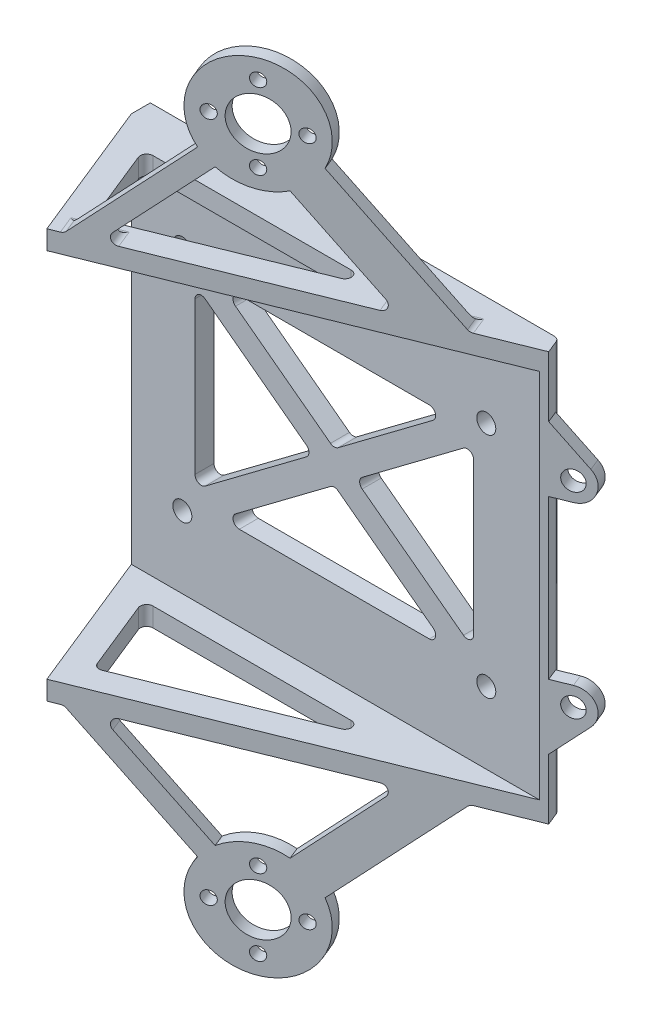
from build123d import *

# Parameters (mm, degrees)
SKETCH_2_W          = 64.445610825
SKETCH_2_H          = 64.602792554
EXTRUDE_2_DEPTH     = 3
SKETCH_3_R          = 1.5
CUT_EXTRUDE_1_DEPTH = 4
EXTRUDE_3_DEPTH     = 3
EXTRUDE_4_DEPTH     = 3
EXTRUDE_6_DEPTH     = 64.602792554
SKETCH_11_R         = 3
SKETCH_11_R_2       = 1.55
SKETCH_11_R_3       = 9
SKETCH_11_R_4       = 1.05
SKETCH_11_R_5       = 4
EXTRUDE_7_DEPTH     = 2
FILLET_1_R          = 1
FILLET_2_R          = 1
FILLET_3_R          = 1
CUT_EXTRUDE_3_DEPTH = 78.212432343
FILLET_5_R          = 1


with BuildPart() as part:
    # 草图2 → 凸台-拉伸2 (new body)
    with BuildSketch(Plane.XY):
        with Locations((0.170214688, -0.018389364)):
            Rectangle(SKETCH_2_W, SKETCH_2_H)
    extrude(amount=EXTRUDE_2_DEPTH)

    # 草图3 → 切除-拉伸1 (cut)
    with BuildSketch(Plane.XY):
        with Locations((24, -18)):
            Circle(SKETCH_3_R)
        with Locations((-24, -18)):
            Circle(SKETCH_3_R)
        with Locations((-24, 18)):
            Circle(SKETCH_3_R)
        with Locations((24, 18)):
            Circle(SKETCH_3_R)
    extrude(amount=CUT_EXTRUDE_1_DEPTH, mode=Mode.SUBTRACT)

    # 草图9 → 凸台-拉伸3 (add)
    with BuildSketch(Plane(origin=(0, 32.283006913, 0), x_dir=(1, 0, 0), z_dir=(0, 1, 0))):
        Polygon((-32.052590724, -3), (32.393020101, -3), (-23.008931723, -25.383841499), align=None)
        Polygon((-20.798622679, -20.176679707), (11.814804037, -7), (-26.12234685, -7), align=None, mode=Mode.SUBTRACT)
    extrude(amount=-EXTRUDE_3_DEPTH)

    # 草图10 → 凸台-拉伸4 (add)
    with BuildSketch(Plane.XZ.offset(32.319785641)):
        Polygon((-23.008931723, 25.383841499), (-32.052590724, 3), (32.393020101, 3), align=None)
        Polygon((11.814804037, 7), (-20.798622679, 20.176679707), (-26.12234685, 7), align=None, mode=Mode.SUBTRACT)
    extrude(amount=-EXTRUDE_4_DEPTH)

    # 草图13 → 凸台-拉伸6 (add)
    with BuildSketch(Plane(origin=(0, 32.283006913, 0), x_dir=(1, 0, 0), z_dir=(0, 1, 0))):
        Polygon((32.393020101, -3), (33.435007656, -2.579009701), (32.393020101, 0), align=None)
    extrude(amount=-EXTRUDE_6_DEPTH)

    # 草图11 → 凸台-拉伸7 (add)
    # profile 1 of 14: a face of its own
    with BuildSketch(Plane(origin=(5.5877033, 0, 13.830050979), x_dir=(0.9271838545667869, 0, -0.37460659341591335), z_dir=(0.37460659341591335, 0, 0.9271838545667869))):
        with BuildLine():
            Line((30.912964894, 13.360290293), (30.034285238, 14.238969949))
            Line((30.034285238, 14.238969949), (30.034285238, 12.481610636))
            Line((30.034285238, 12.481610636), (33.034285238, 12.481610636))
            ThreePointArc((33.034285238, 12.481610636), (31.886234941, 12.709972039), (30.912964894, 13.360290293))
        make_face()
    # profile 2 of 14: a face of its own
    with BuildSketch(Plane(origin=(5.5877033, 0, 13.830050979), x_dir=(0.9271838545667869, 0, -0.37460659341591335), z_dir=(0.37460659341591335, 0, 0.9271838545667869))):
        with Locations((33.034285238, 15.481610636)):
            Circle(SKETCH_11_R)
        with Locations((33.034285238, 15.481610636)):
            Circle(SKETCH_11_R_2, mode=Mode.SUBTRACT)
    # profile 3 of 14: a face of its own
    with BuildSketch(Plane(origin=(5.5877033, 0, 13.830050979), x_dir=(0.9271838545667869, 0, -0.37460659341591335), z_dir=(0.37460659341591335, 0, 0.9271838545667869))):
        with BuildLine():
            Line((30.034285238, 15.481610693), (30.034285238, 14.238969949))
            Line((30.034285238, 14.238969949), (30.912964894, 13.360290293))
            ThreePointArc((30.912964894, 13.360290293), (30.26264663, 14.333560365), (30.034285238, 15.481610693))
        make_face()
    # profile 4 of 14: a face of its own
    with BuildSketch(Plane(origin=(5.5877033, 0, 13.830050979), x_dir=(0.9271838545667869, 0, -0.37460659341591335), z_dir=(0.37460659341591335, 0, 0.9271838545667869))):
        with BuildLine():
            Line((35.155605582, 17.60293098), (30.034285238, 22.724251323))
            Line((30.034285238, 22.724251323), (30.034285238, 15.481610693))
            ThreePointArc((30.034285238, 15.481610693), (31.886234967, 18.253249245), (35.155605582, 17.60293098))
        make_face()
    # profile 5 of 14: a face of its own
    with BuildSketch(Plane(origin=(5.5877033, 0, 13.830050979), x_dir=(0.9271838545667869, 0, -0.37460659341591335), z_dir=(0.37460659341591335, 0, 0.9271838545667869))):
        with Locations((33.034285238, -15.518389364)):
            Circle(SKETCH_11_R)
        with Locations((33.034285238, -15.518389364)):
            Circle(SKETCH_11_R_2, mode=Mode.SUBTRACT)
    # profile 6 of 14: a face of its own
    with BuildSketch(Plane(origin=(5.5877033, 0, 13.830050979), x_dir=(0.9271838545667869, 0, -0.37460659341591335), z_dir=(0.37460659341591335, 0, 0.9271838545667869))):
        with BuildLine():
            Line((30.912964894, -13.39706902), (30.034285238, -14.275748677))
            Line((30.034285238, -14.275748677), (30.034285238, -15.518389325))
            ThreePointArc((30.034285238, -15.518389325), (30.262646648, -14.370339049), (30.912964894, -13.39706902))
        make_face()
    # profile 7 of 14: a face of its own
    with BuildSketch(Plane(origin=(5.5877033, 0, 13.830050979), x_dir=(0.9271838545667869, 0, -0.37460659341591335), z_dir=(0.37460659341591335, 0, 0.9271838545667869))):
        with BuildLine():
            Line((33.034285238, -12.518389364), (30.034285238, -12.518389364))
            Line((30.034285238, -12.518389364), (30.034285238, -14.275748677))
            Line((30.034285238, -14.275748677), (30.912964894, -13.39706902))
            ThreePointArc((30.912964894, -13.39706902), (31.886234941, -12.746750766), (33.034285238, -12.518389364))
        make_face()
    # profile 8 of 14: a face of its own
    with BuildSketch(Plane(origin=(5.5877033, 0, 13.830050979), x_dir=(0.9271838545667869, 0, -0.37460659341591335), z_dir=(0.37460659341591335, 0, 0.9271838545667869))):
        with BuildLine():
            ThreePointArc((35.155605582, -17.639709707), (31.886234923, -18.290027954), (30.034285238, -15.518389325))
            Line((30.034285238, -15.518389325), (30.034285238, -22.761030051))
            Line((30.034285238, -22.761030051), (35.155605582, -17.639709707))
        make_face()
    # profile 9 of 14: a face of its own
    with BuildSketch(Plane(origin=(5.5877033, 0, 13.830050979), x_dir=(0.9271838545667869, 0, -0.37460659341591335), z_dir=(0.37460659341591335, 0, 0.9271838545667869))):
        with BuildLine():
            Line((20.475529648, -32.319785641), (11.990248274, -32.319785641))
            Line((11.990248274, -32.319785641), (-1.337035106, -45.64706902))
            ThreePointArc((-1.337035106, -45.64706902), (1.148246269, -47.404428333), (2.905605582, -49.889709707))
            Line((2.905605582, -49.889709707), (20.475529648, -32.319785641))
        make_face()
    # profile 10 of 14: a face of its own
    with BuildSketch(Plane(origin=(5.5877033, 0, 13.830050979), x_dir=(0.9271838545667869, 0, -0.37460659341591335), z_dir=(0.37460659341591335, 0, 0.9271838545667869))):
        with Locations((-5.215714762, -53.768389364)):
            Circle(SKETCH_11_R_3)
        with Locations((-11.215714762, -53.768389364)):
            Circle(SKETCH_11_R_4, mode=Mode.SUBTRACT)
        with Locations((-5.215714762, -53.768389364)):
            Circle(SKETCH_11_R_5, mode=Mode.SUBTRACT)
        with Locations((-5.215714762, -47.768389364)):
            Circle(SKETCH_11_R_4, mode=Mode.SUBTRACT)
        with Locations((0.784285238, -53.768389364)):
            Circle(SKETCH_11_R_4, mode=Mode.SUBTRACT)
        with Locations((-5.215714762, -59.768389364)):
            Circle(SKETCH_11_R_4, mode=Mode.SUBTRACT)
    # profile 11 of 14: a face of its own
    with BuildSketch(Plane(origin=(5.5877033, 0, 13.830050979), x_dir=(0.9271838545667869, 0, -0.37460659341591335), z_dir=(0.37460659341591335, 0, 0.9271838545667869))):
        with BuildLine():
            Line((-10.430004789, -46.432778993), (-24.542998142, -32.319785641))
            Line((-24.542998142, -32.319785641), (-28.785638829, -32.319785641))
            Line((-28.785638829, -32.319785641), (-12.551325133, -48.554099337))
            ThreePointArc((-12.551325133, -48.554099337), (-11.579675793, -47.404428333), (-10.430004789, -46.432778993))
        make_face()
    # profile 12 of 14: a face of its own
    with BuildSketch(Plane(origin=(5.5877033, 0, 13.830050979), x_dir=(0.9271838545667869, 0, -0.37460659341591335), z_dir=(0.37460659341591335, 0, 0.9271838545667869))):
        with BuildLine():
            Line((20.475529648, 32.283006913), (2.905605582, 49.85293098))
            ThreePointArc((2.905605582, 49.85293098), (1.148246269, 47.367649606), (-1.337035106, 45.610290293))
            Line((-1.337035106, 45.610290293), (11.990248274, 32.283006913))
            Line((11.990248274, 32.283006913), (20.475529648, 32.283006913))
        make_face()
    # profile 13 of 14: a face of its own
    with BuildSketch(Plane(origin=(5.5877033, 0, 13.830050979), x_dir=(0.9271838545667869, 0, -0.37460659341591335), z_dir=(0.37460659341591335, 0, 0.9271838545667869))):
        with BuildLine():
            ThreePointArc((-10.430004789, 46.396000265), (-11.579675793, 47.367649606), (-12.551325133, 48.517320609))
            Line((-12.551325133, 48.517320609), (-28.785638829, 32.283006913))
            Line((-28.785638829, 32.283006913), (-24.542998142, 32.283006913))
            Line((-24.542998142, 32.283006913), (-10.430004789, 46.396000265))
        make_face()
    # profile 14 of 14: a face of its own
    with BuildSketch(Plane(origin=(5.5877033, 0, 13.830050979), x_dir=(0.9271838545667869, 0, -0.37460659341591335), z_dir=(0.37460659341591335, 0, 0.9271838545667869))):
        with Locations((-5.215714762, 53.731610636)):
            Circle(SKETCH_11_R_3)
        with Locations((-11.215714762, 53.731610636)):
            Circle(SKETCH_11_R_4, mode=Mode.SUBTRACT)
        with Locations((-5.215714762, 53.731610636)):
            Circle(SKETCH_11_R_5, mode=Mode.SUBTRACT)
        with Locations((-5.215714762, 59.731610636)):
            Circle(SKETCH_11_R_4, mode=Mode.SUBTRACT)
        with Locations((0.784285238, 53.731610636)):
            Circle(SKETCH_11_R_4, mode=Mode.SUBTRACT)
        with Locations((-5.215714762, 47.731610636)):
            Circle(SKETCH_11_R_4, mode=Mode.SUBTRACT)
    extrude(amount=-EXTRUDE_7_DEPTH)

    # 圆角1
    fillet_1_edges = [part.edges().sort_by_distance(p)[0] for p in [
        (32.393020101, -0.018389364, 0),
    ]]
    fillet(fillet_1_edges, radius=FILLET_1_R)

    # 圆角2
    fillet_2_edges = [part.edges().sort_by_distance(p)[0] for p in [
        (16.330261319, -32.319785641, 8.411241064),
        (24.19767721, -32.319785641, 5.232598715),
        (-21.476482859, -32.319785641, 23.686157226),
        (-17.542774913, -32.319785641, 22.096836051),
        (19.889362671, -32.319785641, 5.894736035),
        (-19.884235479, -32.319785641, 21.964312784),
        (24.19767721, 32.283006913, 5.232598715),
        (16.330261319, 32.283006913, 8.411241064),
        (-17.542774913, 32.283006913, 22.096836051),
        (-21.476482859, 32.283006913, 23.686157226),
        (19.889362671, 32.283006913, 5.894736035),
        (-19.884235479, 32.283006913, 21.964312784),
    ]]
    fillet(fillet_2_edges, radius=FILLET_2_R)

    # 圆角3
    fillet_3_edges = [part.edges().sort_by_distance(p)[0] for p in [
        (-26.12234685, 30.783006913, 7),
        (11.814804037, 30.783006913, 7),
        (-20.798622679, 30.783006913, 20.176679707),
        (-26.12234685, -30.819785641, 7),
        (-20.798622679, -30.819785641, 20.176679707),
        (11.814804037, -30.819785641, 7),
    ]]
    fillet(fillet_3_edges, radius=FILLET_3_R)

    # 草图15 → 切除-拉伸3 (cut, through all)
    with BuildSketch(Plane.XY.offset(3)):
        Polygon((-18, 16), (18, 16), (0, 2.5), align=None)
        Polygon((-22, 14), (-3.333333333, 0), (-22, -14), align=None)
        Polygon((-18, -16), (18, -16), (0, -2.5), align=None)
        Polygon((22, 14), (3.333333333, 0), (22, -14), align=None)
    extrude(amount=-CUT_EXTRUDE_3_DEPTH, mode=Mode.SUBTRACT)

    # 圆角5
    fillet_5_edges = [part.edges().sort_by_distance(p)[0] for p in [
        (-18, -16, 1.5),
        (0, -2.5, 1.5),
        (18, -16, 1.5),
        (-22, -14, 1.5),
        (-22, 14, 1.5),
        (-3.333333333, 0, 1.5),
        (22, 14, 1.5),
        (22, -14, 1.5),
        (3.333333333, 0, 1.5),
        (0, 2.5, 1.5),
        (-18, 16, 1.5),
        (18, 16, 1.5),
    ]]
    fillet(fillet_5_edges, radius=FILLET_5_R)


solid = part.part
